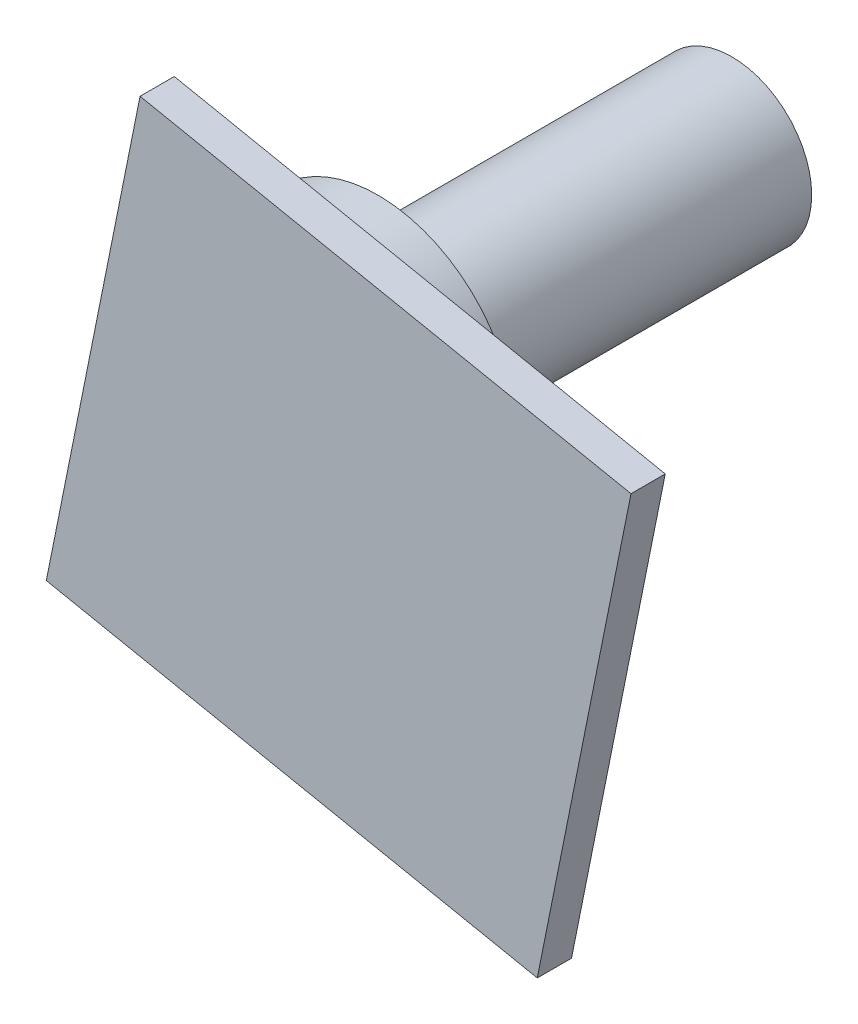
from build123d import *

# Parameters (mm, degrees)
SKETCH_1_R           = 7
EXTRUDE_1_DEPTH      = 34
EXTRUDE_2_DEPTH      = 2
EXTRUDE_2_DEPTH_BACK = 3
SKETCH_2_R           = 12
EXTRUDE_4_DEPTH      = 3


with BuildPart() as part:
    # 草图1 → 凸台-拉伸1 (new body)
    with BuildSketch(Plane.XY):
        with Locations((-86.606649797, -63.783530386)):
            Circle(SKETCH_1_R)
    extrude(amount=EXTRUDE_1_DEPTH)

    # 草图2 → 凸台-拉伸2 (add, two sides: drawn at the far end of the back side and taken through both)
    with BuildSketch(Plane.XY.offset(34).offset(-EXTRUDE_2_DEPTH_BACK)):
        with Locations((-86.606649797, -63.783530386)):
            Circle(SKETCH_2_R)
    extrude(amount=EXTRUDE_2_DEPTH + EXTRUDE_2_DEPTH_BACK)

    # 草图3 → 凸台-拉伸4 (add)
    with BuildSketch(Plane.XY.offset(36)):
        Polygon((-99.453609906, -46.708587879), (-56.43686088, -55.3563008), (-64.649842886, -96.21054618), (-107.666591911, -87.562833258), align=None)
    extrude(amount=EXTRUDE_4_DEPTH)


solid = part.part
